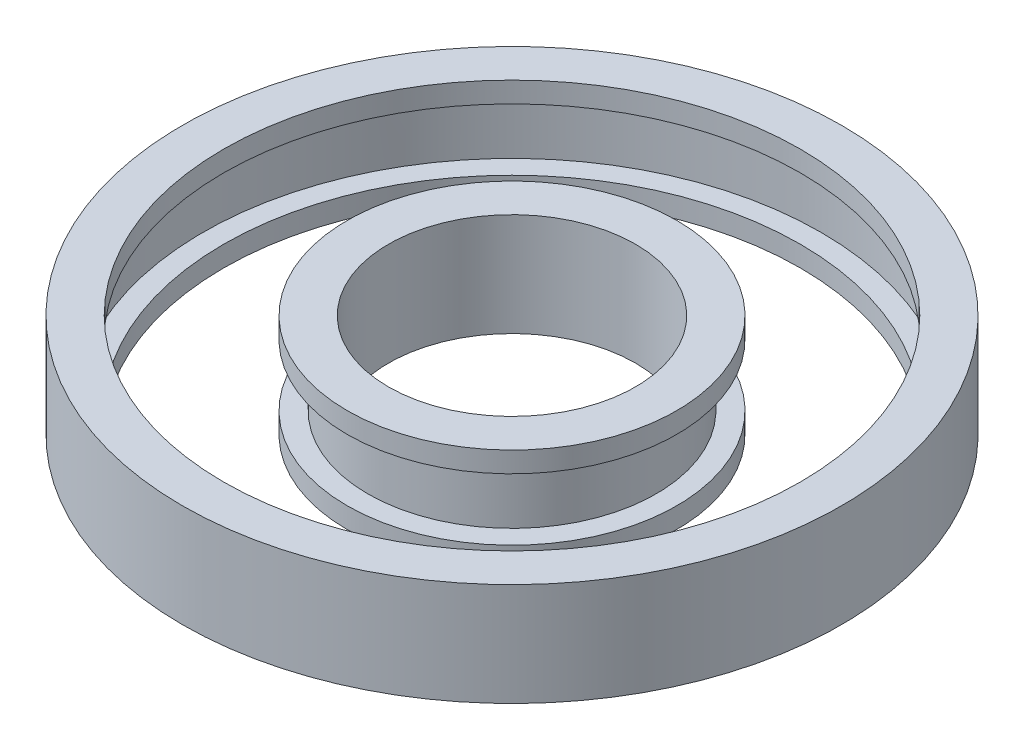
from build123d import *

# Parameters (mm, degrees)
SKETCH21_R          = 32
SKETCH21_R_2        = 30
BOSS_EXTRUDE1_DEPTH = 10
SKETCH22_R          = 14
SKETCH22_R_2        = 12
BOSS_EXTRUDE2_DEPTH = 10
SKETCH23_R          = 30
SKETCH23_R_2        = 28
BOSS_EXTRUDE3_DEPTH = 2
SKETCH24_R          = 16
SKETCH24_R_2        = 14
BOSS_EXTRUDE4_DEPTH = 2
BOSS_EXTRUDE5_START = -2
SKETCH25_R          = 30
SKETCH25_R_2        = 28
BOSS_EXTRUDE5_DEPTH = 2
SKETCH26_R          = 16
SKETCH26_R_2        = 14
BOSS_EXTRUDE6_DEPTH = 2


with BuildPart() as part:
    # Sketch21 → Boss-Extrude1 (new body)
    with BuildSketch(Plane(origin=(0, 0, 0), x_dir=(1, 0, 0), z_dir=(0, 1, 0))):
        with Locations(Location((-29.852518283, -11.525066254, 0), (0, 0, 270))):
            Circle(SKETCH21_R)
        with Locations(Location((-29.852518283, -11.525066254, 0), (0, 0, 270))):
            Circle(SKETCH21_R_2, mode=Mode.SUBTRACT)
    extrude(amount=BOSS_EXTRUDE1_DEPTH)

    # Sketch23 → Boss-Extrude3 (add)
    with BuildSketch(Plane.XZ):
        with Locations(Location((-29.852518283, 11.525066254, 0), (0, 0, 270))):
            Circle(SKETCH23_R)
        with Locations(Location((-29.852518283, 11.525066254, 0), (0, 0, 270))):
            Circle(SKETCH23_R_2, mode=Mode.SUBTRACT)
    extrude(amount=-BOSS_EXTRUDE3_DEPTH)

    # Sketch25 → Boss-Extrude5 (add)
    with BuildSketch(Plane(origin=(0, 10, 0), x_dir=(1, 0, 0), z_dir=(0, 1, 0)).offset(BOSS_EXTRUDE5_START)):
        with Locations(Location((-29.852518283, -11.525066254, 0), (0, 0, 90))):
            Circle(SKETCH25_R)
        with Locations(Location((-29.852518283, -11.525066254, 0), (0, 0, 90))):
            Circle(SKETCH25_R_2, mode=Mode.SUBTRACT)
    extrude(amount=BOSS_EXTRUDE5_DEPTH)


with BuildPart() as body_2:
    # Sketch22 → Boss-Extrude2 (new body)
    with BuildSketch(Plane.XZ):
        with Locations(Location((-29.852518283, 11.525066254, 0), (0, 0, 270))):
            Circle(SKETCH22_R)
        with Locations(Location((-29.852518283, 11.525066254, 0), (0, 0, 270))):
            Circle(SKETCH22_R_2, mode=Mode.SUBTRACT)
    extrude(amount=-BOSS_EXTRUDE2_DEPTH)

    # Sketch24 → Boss-Extrude4 (add)
    with BuildSketch(Plane.XZ):
        with Locations(Location((-29.852518283, 11.525066254, 0), (0, 0, 270))):
            Circle(SKETCH24_R)
        with Locations(Location((-29.852518283, 11.525066254, 0), (0, 0, 270))):
            Circle(SKETCH24_R_2, mode=Mode.SUBTRACT)
    extrude(amount=-BOSS_EXTRUDE4_DEPTH)

    # Sketch26 → Boss-Extrude6 (add)
    with BuildSketch(Plane(origin=(0, 10, 0), x_dir=(1, 0, 0), z_dir=(0, 1, 0))):
        with Locations(Location((-29.852518283, -11.525066254, 0), (0, 0, 90))):
            Circle(SKETCH26_R)
        with Locations(Location((-29.852518283, -11.525066254, 0), (0, 0, 90))):
            Circle(SKETCH26_R_2, mode=Mode.SUBTRACT)
    extrude(amount=-BOSS_EXTRUDE6_DEPTH)


solid = Compound([part.part, body_2.part])
